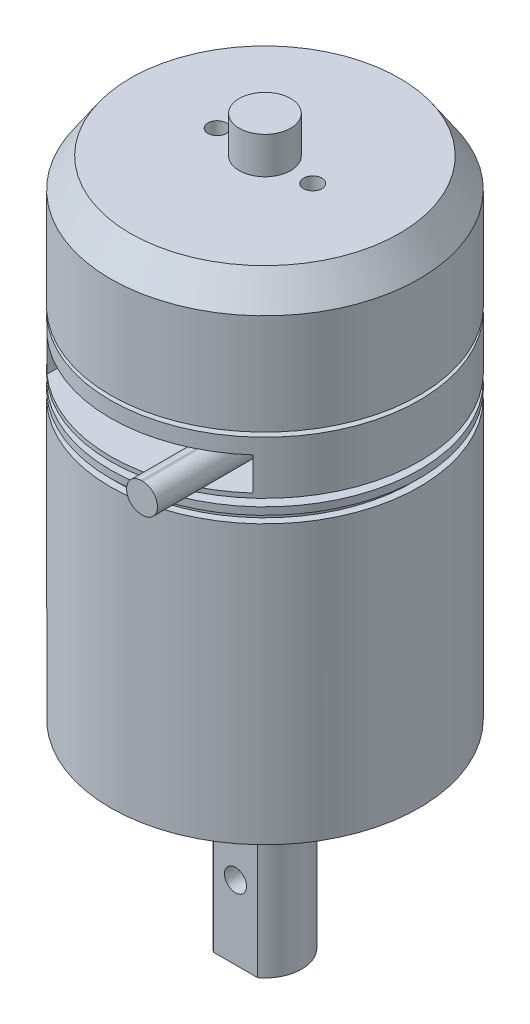
from build123d import *

# Parameters (mm, degrees)
SKETCH_2_W               = 28
SKETCH_2_H               = 4.5
CUT_EXTRUDE_1_DEPTH      = 10
EXTRUDE_1_DEPTH          = 15
HOLE_WIZARD_M3_1_D       = 2.5
HOLE_WIZARD_M3_1_DEPTH   = 4
HOLE_WIZARD_M3_1_TIP     = 0.751075774
CUT_EXTRUDE_START        = -20
CUT_EXTRUDE_2_DEPTH      = 20
HOLE_WIZARD_M4_1_D       = 3.3
HOLE_WIZARD_M4_1_DEPTH   = 10.1
HOLE_WIZARD_M4_1_TIP     = 0.991420021
CUT_EXTRUDE_3_DEPTH      = 64.617293246
CUT_EXTRUDE_3_DEPTH_BACK = 64.617293246
SKETCH_11_R              = 1.5
HOLE_WIZARD_M4_2_D       = 3.3
HOLE_WIZARD_M4_2_DEPTH   = 6
HOLE_WIZARD_M4_2_TIP     = 0.991420021


with BuildPart() as part:
    # 草图1 → 旋转1 (revolve)
    with BuildSketch(Plane.XY, mode=Mode.PRIVATE) as revolve_1_sk:
        Polygon((0, 0), (4.1, 0), (4.1, 6.7), (13.4, 6.7), (13.4, 8.7), (21, 8.7), (21, 10.2), (20, 10.2), (20, 11.2), (21, 11.2), (21, 12.2), (10, 12.2), (10, 13.2), (21, 13.2), (21, 20.4), (5, 20.4), (5, 21), (21, 21), (21, 34.7), (18.3, 38.7), (3.5, 38.7), (3.5, 43.7), (0, 43.7), align=None)
    revolve(revolve_1_sk.sketch.rotate(Axis((0, 43.7, 0), (0, -1, 0)), 90), axis=Axis((0, 43.7, 0), (0, -1, 0)))

    # 草图2 → 切除-拉伸1 (cut)
    with BuildSketch(Plane.XY.offset(21)):
        with Locations((0, 16.05)):
            Rectangle(SKETCH_2_W, SKETCH_2_H)
    extrude(amount=-CUT_EXTRUDE_1_DEPTH, mode=Mode.SUBTRACT)

    # 草图3 → 凸台-拉伸1 (add)
    with BuildSketch(Plane.XY.offset(11)):
        with BuildLine():
            Line((9.185056323, 18.053194417), (9.385056323, 18.053194417))
            ThreePointArc((9.385056323, 18.053194417), (11.385056323, 16.053194417), (9.385056323, 14.053194417))
            Line((9.385056323, 14.053194417), (9.185056323, 14.053194417))
            ThreePointArc((9.185056323, 14.053194417), (7.185056323, 16.053194417), (9.185056323, 18.053194417))
        make_face()
    extrude(amount=EXTRUDE_1_DEPTH)

    # M3 螺纹孔1
    with Locations(Plane(origin=(0, 38.7, 0), x_dir=(1, 0, 0), z_dir=(0, 1, 0))):
        with Locations((-6.5, 0), (6.5, 0)):
            Hole(HOLE_WIZARD_M3_1_D / 2, depth=HOLE_WIZARD_M3_1_DEPTH)
            with Locations((0, 0, -(HOLE_WIZARD_M3_1_DEPTH + HOLE_WIZARD_M3_1_TIP / 2))):  # 118° drill point
                Cone(0, HOLE_WIZARD_M3_1_D / 2, HOLE_WIZARD_M3_1_TIP, mode=Mode.SUBTRACT)

    # 草图7 → 旋转2 (revolve)
    with BuildSketch(Plane.XY, mode=Mode.PRIVATE) as revolve_2_sk:
        Polygon((0, -54.6), (5, -54.6), (5, -30.5), (8.275, -30.5), (8.275, -29.6), (13, -29.6), (13, -27.6), (21, -27.6), (21, 8.7), (0, 8.7), align=None)
    revolve(revolve_2_sk.sketch.rotate(Axis((0, 8.7, 0), (0, -1, 0)), 180), axis=Axis((0, 8.7, 0), (0, -1, 0)))

    # 草图8 → 切除-拉伸2 (cut)
    with BuildSketch(Plane.XZ.offset(54.6).offset(CUT_EXTRUDE_START)):
        with BuildLine():
            Line((-3, 4), (3, 4))
            ThreePointArc((3, 4), (0, 5), (-3, 4))
        make_face()
    extrude(amount=CUT_EXTRUDE_2_DEPTH, mode=Mode.SUBTRACT)

    # M4 螺纹孔1
    with Locations(Plane(origin=(0, -27.6, 0), x_dir=(-1, 0, 0), z_dir=(0, -1, 0))):
        with Locations((0, -17.5), (-17.5, 0), (0, 17.5), (17.5, 0)):
            Hole(HOLE_WIZARD_M4_1_D / 2, depth=HOLE_WIZARD_M4_1_DEPTH)
            with Locations((0, 0, -(HOLE_WIZARD_M4_1_DEPTH + HOLE_WIZARD_M4_1_TIP / 2))):  # 118° drill point
                Cone(0, HOLE_WIZARD_M4_1_D / 2, HOLE_WIZARD_M4_1_TIP, mode=Mode.SUBTRACT)

    # 草图11 → 切除-拉伸3 (cut, two sides: drawn at the far end of the back side and taken through both)
    with BuildSketch(Plane.XY.offset(4).offset(-CUT_EXTRUDE_3_DEPTH_BACK)):
        with Locations((0, -44.6)):
            Circle(SKETCH_11_R)
    extrude(amount=CUT_EXTRUDE_3_DEPTH + CUT_EXTRUDE_3_DEPTH_BACK, mode=Mode.SUBTRACT)

    # M4 螺纹孔2
    with Locations(Plane(origin=(0, -54.6, 0), x_dir=(-1, 0, 0), z_dir=(0, -1, 0))):
        with Locations((0, 0)):
            Hole(HOLE_WIZARD_M4_2_D / 2, depth=HOLE_WIZARD_M4_2_DEPTH)
            with Locations((0, 0, -(HOLE_WIZARD_M4_2_DEPTH + HOLE_WIZARD_M4_2_TIP / 2))):  # 118° drill point
                Cone(0, HOLE_WIZARD_M4_2_D / 2, HOLE_WIZARD_M4_2_TIP, mode=Mode.SUBTRACT)


solid = part.part
